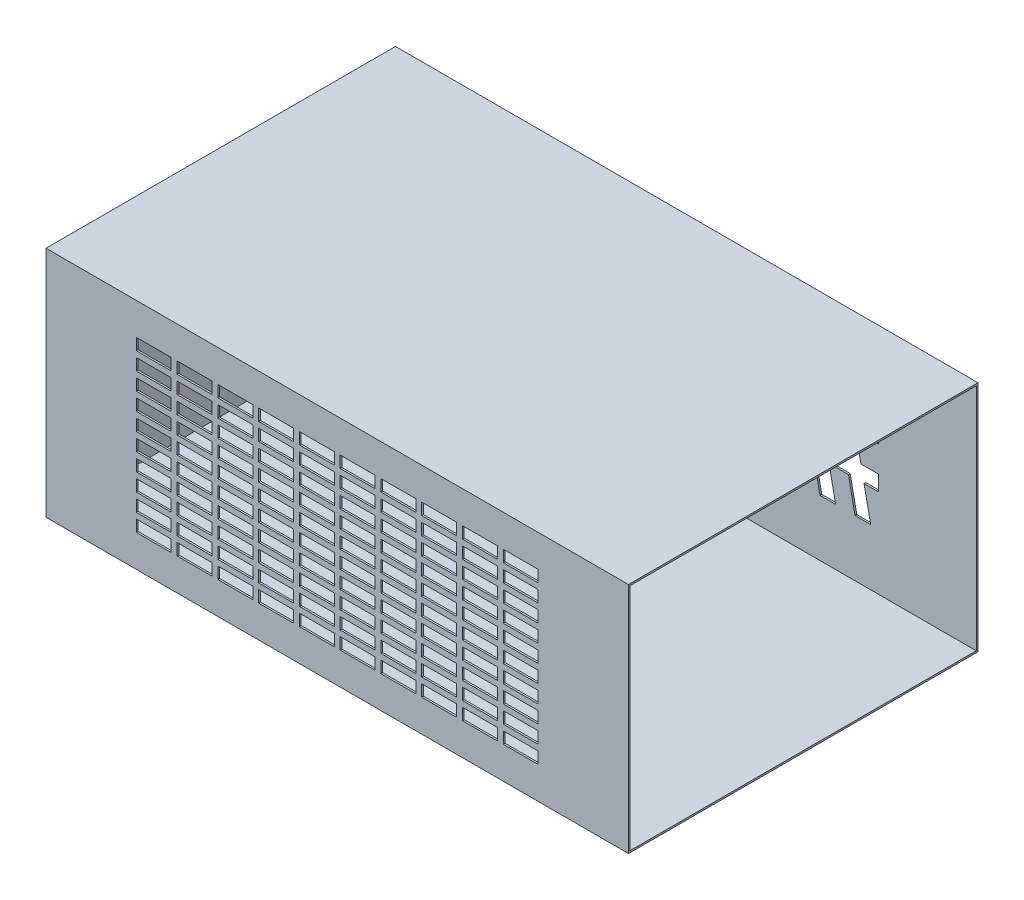
from build123d import *

# Parameters (mm, degrees)
SKETCH_1_W                  = 500
SKETCH_1_H                  = 200
EXTRUDE_2_DEPTH             = 150
SHELL_3_T                   = -1.5
CUT_EXTRUDE_1_REACH         = 405.113
SKETCH_5_W                  = 30
SKETCH_5_H                  = 10
PATTERN_LINEAR_1_COUNT      = 10
PATTERN_LINEAR_1_PITCH      = 35
PATTERN_LINEAR_1_COUNT_DIR2 = 10
PATTERN_LINEAR_1_PITCH_DIR2 = 15
CUT_EXTRUDE_3_DEPTH         = 1.5


with BuildPart() as part:
    # Эскиз1 → Бобышка-Вытянуть2 (new, symmetric)
    with BuildSketch(Plane.XY):
        Rectangle(SKETCH_1_W, SKETCH_1_H)
    extrude(amount=EXTRUDE_2_DEPTH, both=True)

    # Оболочка3
    shell_3_openings = [part.faces().sort_by_distance(p)[0] for p in [
        (250, 0, 0),
    ]]
    offset(amount=SHELL_3_T, openings=shell_3_openings, kind=Kind.INTERSECTION)

    # Эскиз5 → Вырез-Вытянуть1 (cut, up to next)
    with BuildSketch(Plane.XY.offset(150), mode=Mode.PRIVATE) as cut_extrude_1_sk1:
        with Locations((-157.5, 67.5)):
            Rectangle(SKETCH_5_W, SKETCH_5_H)
    cut_extrude_1_tool1 = extrude(cut_extrude_1_sk1.sketch, amount=-CUT_EXTRUDE_1_REACH, mode=Mode.PRIVATE) & part.part
    cut_extrude_1 = cut_extrude_1_tool1.solids().sort_by_distance((-157.5, 67.5, 150))[0]
    add(cut_extrude_1, mode=Mode.SUBTRACT)

    # Линейный массив1: Cut-Extrude 1 10 × 10
    with Locations(*[(i * PATTERN_LINEAR_1_PITCH, -j * PATTERN_LINEAR_1_PITCH_DIR2, 0) for i in range(PATTERN_LINEAR_1_COUNT) for j in range(PATTERN_LINEAR_1_COUNT_DIR2) if (i, j) != (0, 0)]):
        add(cut_extrude_1, mode=Mode.SUBTRACT)

    # Эскиз8 → Вырез-Вытянуть3 (cut)
    # profile 1 of 4: a face of its own
    with BuildSketch(Plane(origin=(0, 0, -150), x_dir=(-1, 0, 0), z_dir=(0, 0, -1))):
        Polygon((-159.367467114, -50), (-153.687531561, -22.341183393), (-165.952899639, -22.341183393), (-165.952899639, -9.170318343), (-150.991620121, -9.170318343), (-146.40239683, 13.220152244), (-165.952899639, 13.220152244), (-165.952899639, 26.391017294), (-143.70648539, 26.391017294), (-138.294083033, 52.732747396), (-124.896843739, 52.732747396), (-130.309246096, 26.391017294), (-113.639870016, 26.391017294), (-108.227467659, 52.732747396), (-94.830228365, 52.732747396), (-100.242630722, 26.391017294), (-88.24479584, 26.391017294), (-88.24479584, 13.220152244), (-102.938542162, 13.220152244), (-107.527765453, -9.170318343), (-88.24479584, -9.170318343), (-88.24479584, -22.341183393), (-110.223676893, -22.341183393), (-115.903612447, -50), (-129.30085174, -50), (-123.620916187, -22.341183393), (-140.290292267, -22.341183393), (-145.97022782, -50), align=None)
        Polygon((-137.594380827, -9.170318343), (-120.925004747, -9.170318343), (-116.335781456, 13.220152244), (-133.005157536, 13.220152244), align=None, mode=Mode.SUBTRACT)
    # profile 2 of 4: a face of its own
    with BuildSketch(Plane(origin=(0, 0, -150), x_dir=(-1, 0, 0), z_dir=(0, 0, -1))):
        with BuildLine():
            add(Edge.make_bspline(
                [(-80.34227681, 0.666671492), (-80.32900716, 2.134816752), (-80.303017505, 5.010295064), (-80.141812117, 9.217636396), (-79.860360571, 13.213174248), (-79.440230896, 16.993438682), (-78.942718649, 20.566962497), (-78.295949589, 23.928645906), (-77.568240372, 27.086031389), (-76.695119901, 30.035827881), (-75.735846334, 32.803398263), (-74.647519868, 35.384302727), (-73.423004958, 37.775804907), (-72.122478901, 40.002706023), (-70.67747934, 42.030368596), (-69.175223549, 43.915697139), (-67.506536549, 45.589549298), (-65.740805923, 47.094993441), (-63.852030831, 48.423460165), (-61.850204769, 49.569766711), (-59.743030217, 50.581872739), (-57.490346761, 51.343785892), (-55.138919674, 51.96490663), (-52.670648891, 52.421810576), (-50.082814416, 52.691170872), (-48.314393317, 52.71873199), (-47.415114183, 52.732747396)],
                knots=[0, 0, 0, 0, 1.514747001, 2.966751498, 4.343369068, 5.64627492, 6.890416844, 8.064737671, 9.177176366, 10.232018008, 11.237056675, 12.19799043, 13.119080079, 14.007588942, 14.855863561, 15.685992447, 16.491747269, 17.290132607, 18.077525251, 18.870243746, 19.668095604, 20.485086593, 21.319398728, 22.175900658, 23.072407314, 24, 24, 24, 24], degree=3))
            add(Edge.make_bspline(
                [(-47.415114183, 52.732747396), (-46.095754727, 52.693959162), (-43.503820156, 52.61775812), (-39.719582297, 51.996276248), (-36.153182015, 50.933135723), (-32.806936374, 49.498913291), (-29.738048924, 47.677174762), (-26.997403082, 45.462574029), (-24.614561141, 42.878363964), (-22.615528132, 39.893922523), (-20.868173746, 36.591580532), (-19.315862468, 32.956515863), (-17.912618159, 28.992802015), (-16.91684545, 25.444724781), (-16.206561594, 22.381898616), (-15.736410116, 19.855766237), (-15.346090133, 17.130055179), (-15.047052276, 14.211359669), (-14.801698771, 11.102953286), (-14.612223503, 7.802900676), (-14.516045404, 4.302953919), (-14.497491728, 1.901488517), (-14.487951556, 0.666671492)],
                knots=[0, 0, 0, 0, 1.134486744, 2.228744715, 3.287356444, 4.328707449, 5.352829806, 6.347195599, 7.349461267, 8.364207941, 9.428085653, 10.559314403, 11.761222316, 13.04268526, 13.726896727, 14.465273606, 15.252205015, 16.094778733, 16.988606776, 17.934225168, 18.937792761, 20, 20, 20, 20], degree=3))
            add(Edge.make_bspline(
                [(-14.487951556, 0.666671492), (-14.501469768, -0.794577675), (-14.527880255, -3.649415554), (-14.684766069, -7.823021098), (-14.983177043, -11.788414563), (-15.350377198, -15.55467951), (-15.905874119, -19.111761785), (-16.504452149, -22.474774489), (-17.244745315, -25.628446584), (-18.108493637, -28.574160242), (-19.081270384, -31.327491337), (-20.148070616, -33.909248013), (-21.329654307, -36.317666125), (-22.661189848, -38.52925517), (-24.081753458, -40.57337029), (-25.601749254, -42.45767942), (-27.253402928, -44.155061906), (-29.035045536, -45.655990527), (-30.910559052, -47.008015704), (-32.917251921, -48.165639758), (-35.046341159, -49.124711179), (-37.283601503, -49.944669596), (-39.651733186, -50.54548703), (-42.132061342, -51.005403388), (-44.733724811, -51.276235446), (-46.50898601, -51.303281611), (-47.415114183, -51.317086505)],
                knots=[0, 0, 0, 0, 1.508974709, 2.94807912, 4.311757619, 5.615040294, 6.854280449, 8.028314546, 9.141715822, 10.197470207, 11.196696834, 12.155719058, 13.080757287, 13.963948316, 14.818758719, 15.649605906, 16.461113142, 17.260189315, 18.052359509, 18.845763934, 19.647754795, 20.461145776, 21.303032214, 22.167241874, 23.064524267, 24, 24, 24, 24], degree=3))
            add(Edge.make_bspline(
                [(-47.415114183, -51.317086505), (-48.60315328, -51.283197627), (-50.919502528, -51.217123642), (-54.302359807, -50.768191614), (-57.477351803, -49.978050166), (-60.471257756, -48.91835907), (-63.250425343, -47.500961206), (-65.828123984, -45.77641993), (-68.256150677, -43.784858515), (-69.653870451, -42.213562274), (-70.361230638, -41.41835824)],
                knots=[0, 0, 0, 0, 1.10322584, 2.150986741, 3.161425019, 4.136713905, 5.093944212, 6.049774532, 7.013026876, 8, 8, 8, 8], degree=3))
            add(Edge.make_bspline(
                [(-70.361230638, -41.41835824), (-71.175418484, -40.243880328), (-72.854308675, -37.822056597), (-74.819304076, -33.692622483), (-76.572114763, -29.146695308), (-77.947749783, -24.09508452), (-79.025214922, -18.57799523), (-79.803413762, -12.584601734), (-80.243797692, -6.117493375), (-80.308709401, -1.645766314), (-80.34227681, 0.666671492)],
                knots=[0, 0, 0, 0, 0.779365345, 1.607084704, 2.489375761, 3.438383567, 4.461919411, 5.557722155, 6.737039282, 8, 8, 8, 8], degree=3))
        make_face()
        with BuildLine():
            add(Edge.make_bspline(
                [(-67.171411759, 0.707830445), (-67.158334137, -1.268093949), (-67.133300677, -5.050450297), (-66.87176178, -10.454198906), (-66.421533334, -15.329117768), (-65.826301922, -19.668457237), (-65.040355458, -23.47808713), (-64.053506717, -26.748299335), (-62.941093466, -29.518343814), (-61.564503148, -31.753887997), (-60.057288796, -33.576182624), (-58.501192982, -35.143414935), (-56.859606152, -36.475526514), (-55.143239462, -37.586235905), (-53.325462247, -38.427192082), (-51.426151598, -39.036718991), (-49.444894243, -39.387492369), (-48.095567955, -39.437891903), (-47.415114183, -39.463307959)],
                knots=[0, 0, 0, 0, 1.89448813, 3.626469325, 5.185477471, 6.587276848, 7.82441448, 8.910550357, 9.859733512, 10.6775885, 11.416198291, 12.123144072, 12.791880183, 13.439617036, 14.078171869, 14.70637855, 15.347637704, 16, 16, 16, 16], degree=3))
            add(Edge.make_bspline(
                [(-47.415114183, -39.463307959), (-46.734830804, -39.437336559), (-45.385842403, -39.385835788), (-43.400007171, -39.042797303), (-41.508086302, -38.401892367), (-39.69301939, -37.56390644), (-37.964177632, -36.478513457), (-36.330653124, -35.141370191), (-34.766360111, -33.575068451), (-33.265916127, -31.731592968), (-31.899813509, -29.485713121), (-30.766532752, -26.717925123), (-29.795063498, -23.441985801), (-29.004804394, -19.634296898), (-28.407117563, -15.301818248), (-27.959611249, -10.440420204), (-27.696322071, -5.043624453), (-27.671701746, -1.268102863), (-27.658816607, 0.707830445)],
                knots=[0, 0, 0, 0, 0.652509534, 1.29391342, 1.924290653, 2.562989607, 3.207355802, 3.876242846, 4.583348185, 5.32723334, 6.150888545, 7.094226006, 8.186903555, 9.424320409, 10.81992305, 12.379283064, 14.105084285, 16, 16, 16, 16], degree=3))
            add(Edge.make_bspline(
                [(-27.658816607, 0.707830445), (-27.671289185, 2.642650976), (-27.695186175, 6.349693894), (-27.965265941, 11.649339154), (-28.388505209, 16.442434492), (-28.96742929, 20.733398698), (-29.736819286, 24.517573341), (-30.669984398, 27.803014415), (-31.781990158, 30.582715184), (-33.10416104, 32.884597795), (-34.576001779, 34.772766012), (-36.11347896, 36.407139896), (-37.755029667, 37.797121638), (-39.529737239, 38.912185496), (-41.380399514, 39.811777542), (-43.349540007, 40.430899697), (-45.417803622, 40.811268983), (-46.837226108, 40.856144391), (-47.559170519, 40.87896885)],
                knots=[0, 0, 0, 0, 1.850066095, 3.544656626, 5.0727657, 6.45041401, 7.682899467, 8.762389858, 9.712573485, 10.538438529, 11.291566246, 11.996865408, 12.681389046, 13.341983376, 13.996294293, 14.643563182, 15.31009126, 16, 16, 16, 16], degree=3))
            add(Edge.make_bspline(
                [(-47.559170519, 40.87896885), (-48.239581555, 40.861110746), (-49.581264929, 40.825896854), (-51.545665098, 40.489780606), (-53.407304061, 39.927719324), (-55.187510183, 39.166352742), (-56.841841567, 38.141703707), (-58.435904883, 36.945353024), (-59.895040371, 35.487733247), (-60.774302614, 34.398039486), (-61.223943009, 33.840787839)],
                knots=[0, 0, 0, 0, 1.021318143, 2.013908504, 2.982026795, 3.937174072, 4.91255697, 5.897578595, 6.924855925, 8, 8, 8, 8], degree=3))
            add(Edge.make_bspline(
                [(-61.223943009, 33.840787839), (-61.713464226, 33.022357767), (-62.747229966, 31.294005773), (-63.903953721, 28.290058799), (-64.925757759, 24.857119194), (-65.767041257, 20.942368688), (-66.375650848, 16.552522655), (-66.856124588, 11.692679069), (-67.105712811, 6.356053008), (-67.148907891, 2.642516718), (-67.171411759, 0.707830445)],
                knots=[0, 0, 0, 0, 0.671104906, 1.417232262, 2.260109084, 3.195198885, 4.23592645, 5.382417421, 6.636286093, 8, 8, 8, 8], degree=3))
        make_face(mode=Mode.SUBTRACT)
    # profile 3 of 4: a face of its own
    with BuildSketch(Plane(origin=(0, 0, -150), x_dir=(-1, 0, 0), z_dir=(0, 0, -1))):
        Polygon((3.951259515, -50), (3.951259515, 52.732747396), (72.439757779, 52.732747396), (72.439757779, 40.87896885), (18.439211071, 40.87896885), (18.439211071, 7.951806223), (64.537238749, 7.951806223), (64.537238749, -3.901972322), (18.439211071, -3.901972322), (18.439211071, -50), align=None)
    # profile 4 of 4: a face of its own
    with BuildSketch(Plane(origin=(0, 0, -150), x_dir=(-1, 0, 0), z_dir=(0, 0, -1))):
        Polygon((90.87896885, -50), (90.87896885, 52.732747396), (159.367467114, 52.732747396), (159.367467114, 40.87896885), (105.366920406, 40.87896885), (105.366920406, 7.951806223), (151.464948084, 7.951806223), (151.464948084, -3.901972322), (105.366920406, -3.901972322), (105.366920406, -50), align=None)
    extrude(amount=-CUT_EXTRUDE_3_DEPTH, mode=Mode.SUBTRACT)


with BuildPart() as cut_extrude_3_piece_1:
    # of the separate pieces the step leaves, piece 1, a body of its own (cut_extrude_3_pieces)
    add(part.part.solids().sort_by_distance((250, -100, -150))[0])


with BuildPart() as cut_extrude_3_piece_2:
    # of the separate pieces the step leaves, piece 2, a body of its own (cut_extrude_3_pieces)
    add(part.part.solids().sort_by_distance((61.223943009, 33.840787839, -150))[0])


with BuildPart() as cut_extrude_3_piece_3:
    # of the separate pieces the step leaves, piece 3, a body of its own (cut_extrude_3_pieces)
    add(part.part.solids().sort_by_distance((133.005157536, 13.220152244, -150))[0])


solid = Compound([cut_extrude_3_piece_1.part, cut_extrude_3_piece_2.part, cut_extrude_3_piece_3.part])
